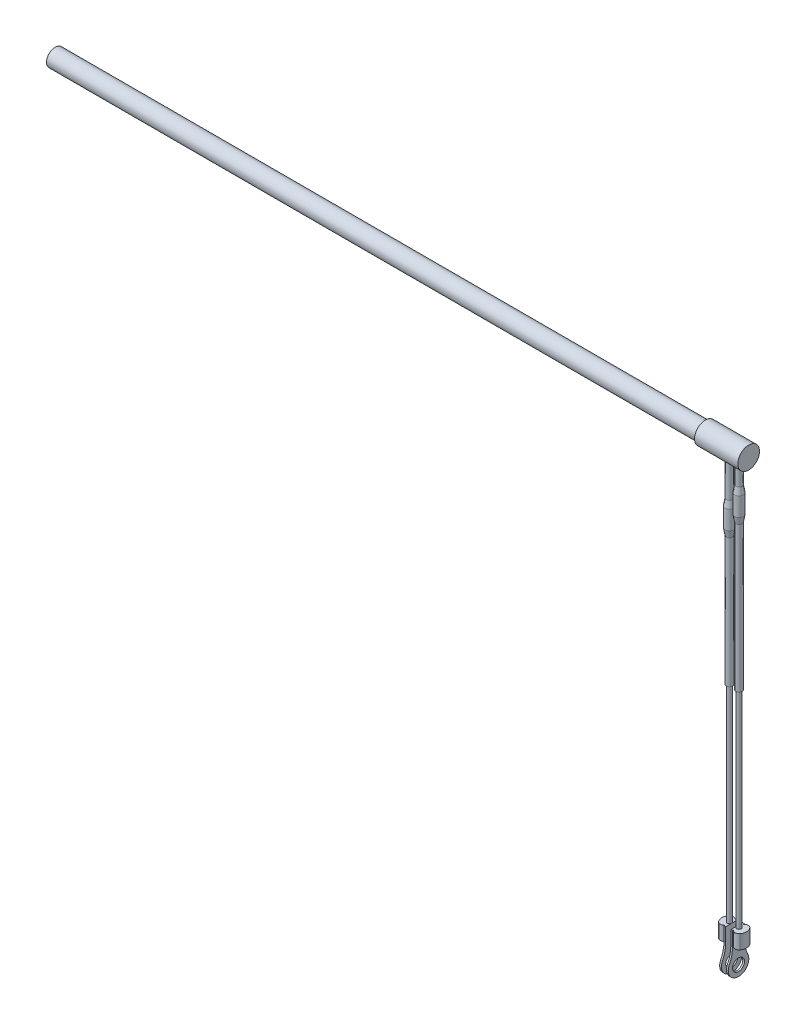
from build123d import *

# Parameters (mm, degrees)
SKETCH4_R           = 25.817449465
CUT_EXTRUDE1_DEPTH  = 20
BOSS_EXTRUDE2_DEPTH = 6.5
BOSS_EXTRUDE3_DEPTH = 6.5
SKETCH7_R           = 2.75
BOSS_EXTRUDE4_DEPTH = 0.8
BOSS_EXTRUDE5_START = -0.8
SKETCH8_R           = 2.75
BOSS_EXTRUDE5_DEPTH = 0.8


with BuildPart() as part:
    # Sketch1 → Revolve1 (revolve)
    with BuildSketch(Plane.XY, mode=Mode.PRIVATE) as revolve1_sk:
        Polygon((-313.333333333, 0), (-313.333333333, 4), (-13.333333333, 4), (-13.333333333, 5), (6.666666667, 5), (6.666666667, 0), align=None)
    revolve(revolve1_sk.sketch.rotate(Axis((6.666666667, 0, 0), (-1, 0, 0)), 270), axis=Axis((6.666666667, 0, 0), (-1, 0, 0)))

    # Sketch2 → Revolve2 (revolve)
    with BuildSketch(Plane.XY, mode=Mode.PRIVATE) as revolve2_sk:
        Polygon((2.2, -4), (3.64, -4), (3.64, -13), (4.2, -16.175917819), (4.2, -24.824082181), (3.64, -28), (3.64, -95), (3.24, -95), (3.24, -195), (2.2, -195), align=None)
    revolve(revolve2_sk.sketch.rotate(Axis((2.2, -195, 0), (0, 1, 0)), 270), axis=Axis((2.2, -195, 0), (0, 1, 0)))

    # Sketch3 → Revolve3 (revolve)
    with BuildSketch(Plane.XY, mode=Mode.PRIVATE) as revolve3_sk:
        Polygon((-2.2, -195), (-3.24, -195), (-3.24, -95), (-3.64, -95), (-3.64, -35.5), (-4.2, -32.324082181), (-4.2, -23.675917819), (-3.64, -20.5), (-3.64, -4), (-2.2, -4), align=None)
    revolve(revolve3_sk.sketch.rotate(Axis((-2.2, -4, 0), (0, -1, 0)), 90), axis=Axis((-2.2, -4, 0), (0, -1, 0)))

    # Sketch4 → Cut-Extrude1 (cut)
    with BuildSketch(Plane(origin=(0, -190, 0), x_dir=(-1, 0, 0), z_dir=(0, 1, 0))):
        Circle(SKETCH4_R)
    extrude(amount=-CUT_EXTRUDE1_DEPTH, mode=Mode.SUBTRACT)

    # Sketch5 → Boss-Extrude2 (add)
    with BuildSketch(Plane(origin=(0, -190, 0), x_dir=(-1, 0, 0), z_dir=(0, 1, 0))):
        with BuildLine():
            ThreePointArc((-1.930000033, -2.250000045), (-1.18, 2e-09), (-1.930000036, 2.250000048))
            ThreePointArc((-1.930000036, 2.250000048), (-3.43000003, 3), (-4.93, 2.25))
            ThreePointArc((-4.93, 2.25), (-5.68, 0), (-4.93, -2.25))
            ThreePointArc((-4.93, -2.25), (-3.430000028, -3), (-1.930000033, -2.250000045))
        make_face()
    extrude(amount=-BOSS_EXTRUDE2_DEPTH)

    # Sketch6 → Boss-Extrude3 (add)
    with BuildSketch(Plane(origin=(0, -190, 0), x_dir=(-1, 0, 0), z_dir=(0, 1, 0))):
        with BuildLine():
            ThreePointArc((4.929999975, -2.250000034), (5.68, -2.1e-08), (4.93, 2.25))
            ThreePointArc((4.93, 2.25), (3.430000035, 3), (1.930000042, 2.250000056))
            ThreePointArc((1.930000042, 2.250000056), (1.18, 5e-09), (1.930000036, -2.250000048))
            ThreePointArc((1.930000036, -2.250000048), (3.430000009, -3), (4.929999975, -2.250000034))
        make_face()
    extrude(amount=-BOSS_EXTRUDE3_DEPTH)

    # Sketch7 → Boss-Extrude4 (add)
    with BuildSketch(Plane(origin=(1.18, 0, 0), x_dir=(0, 0, -1), z_dir=(1, 0, 0))):
        with BuildLine():
            Line((2.75, -196.339745962), (2.75, -190))
            Line((2.75, -190), (-2.75, -190))
            Line((-2.75, -190), (-2.75, -196.339745962))
            ThreePointArc((-2.75, -196.339745962), (-3.134679445, -199.715009665), (-4.268987342, -202.917154092))
            ThreePointArc((-4.268987342, -202.917154092), (0, -209.75), (4.268987342, -202.917154092))
            ThreePointArc((4.268987342, -202.917154092), (3.134679445, -199.715009665), (2.75, -196.339745962))
        make_face()
        with Locations((0, -205)):
            Circle(SKETCH7_R, mode=Mode.SUBTRACT)
    extrude(amount=BOSS_EXTRUDE4_DEPTH)

    # Sketch8 → Boss-Extrude5 (add)
    with BuildSketch(Plane(origin=(-1.18, 0, 0), x_dir=(0, 0, -1), z_dir=(1, 0, 0)).offset(BOSS_EXTRUDE5_START)):
        with BuildLine():
            Line((2.75, -196.339745962), (2.75, -190))
            Line((2.75, -190), (-2.75, -190))
            Line((-2.75, -190), (-2.75, -196.339745962))
            ThreePointArc((-2.75, -196.339745962), (-3.134679445, -199.715009665), (-4.268987342, -202.917154092))
            ThreePointArc((-4.268987342, -202.917154092), (0, -209.75), (4.268987342, -202.917154092))
            ThreePointArc((4.268987342, -202.917154092), (3.134679445, -199.715009665), (2.75, -196.339745962))
        make_face()
        with Locations((0, -205)):
            Circle(SKETCH8_R, mode=Mode.SUBTRACT)
    extrude(amount=BOSS_EXTRUDE5_DEPTH)


solid = part.part
